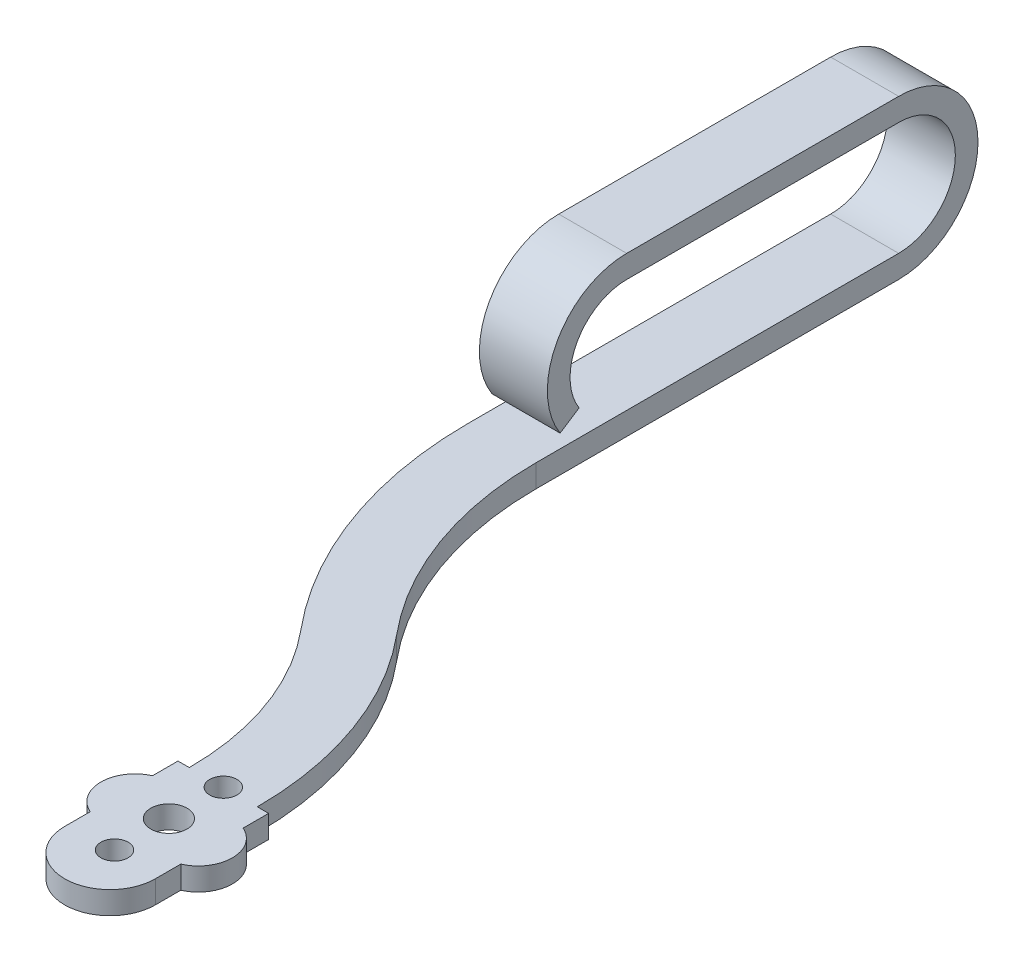
from build123d import *

# Parameters (mm, degrees)
SCHIZZO2_W                   = 15
SCHIZZO2_H                   = 5
SCHIZZO5_W                   = 15
SCHIZZO5_H                   = 5
SCHIZZO9_R                   = 3
SCHIZZO9_R_2                 = 4
ESTRUSIONE_ESTRUSIONE1_DEPTH = 5
SCHIZZO10_R                  = 3
TAGLIO_ESTRUSIONE1_DEPTH     = 144.674980425


with BuildPart() as part:
    # Sweep1: sweep along a path in Schizzo1
    with BuildLine(Plane.ZY) as sweep1_path:
        Line((0, 0), (-80, 0))
        ThreePointArc((-80, 0), (-97.5, 17.5), (-80, 35))
        Line((-80, 35), (-20, 35))
        ThreePointArc((-20, 35), (-4.629573851, 25.866600265), (-5.303061543, 8))
    # Schizzo2 → Sweep1 (sweep)
    with BuildSketch(Plane(origin=(0, 0, 0), x_dir=(-1, 0, 0), z_dir=(0, 0, -1))):
        with Locations((0, 2.5)):
            Rectangle(SCHIZZO2_W, SCHIZZO2_H)
    sweep(path=sweep1_path.line)

    # Sweep2: sweep along a path in Schizzo3
    with BuildLine(Plane.XZ) as sweep2_path:
        ThreePointArc((42.5, 96.5), (37.98987096, 70.837222968), (25, 48.25))
        ThreePointArc((25, 48.25), (12.01012904, 25.662777032), (7.5, 0))
    # Schizzo5 → Sweep2 (sweep)
    with BuildSketch(Plane.XY):
        with Locations((0, 2.5)):
            Rectangle(SCHIZZO5_W, SCHIZZO5_H)
    sweep(path=sweep2_path.line)

    # Schizzo9 → Estrusione-Estrusione1 (add)
    with BuildSketch(Plane.XZ):
        with BuildLine():
            Line((25, 96.5), (45, 96.5))
            Line((45, 96.5), (45, 102.126136458))
            ThreePointArc((45, 102.126136458), (49.5, 109), (45, 115.873863542))
            Line((45, 115.873863542), (45, 121.5))
            ThreePointArc((45, 121.5), (35, 131.5), (25, 121.5))
            Line((25, 121.5), (25, 115.873863542))
            ThreePointArc((25, 115.873863542), (20.5, 109), (25, 102.126136458))
            Line((25, 102.126136458), (25, 96.5))
        make_face()
        with Locations(Location((35, 120.5, 0), (0, 0, 270))):
            Circle(SCHIZZO9_R, mode=Mode.SUBTRACT)
        with Locations(Location((35, 108.5, 0), (0, 0, 270))):
            Circle(SCHIZZO9_R_2, mode=Mode.SUBTRACT)
    extrude(amount=-ESTRUSIONE_ESTRUSIONE1_DEPTH)

    # Schizzo10 → Taglio-Estrusione1 (cut, through all)
    with BuildSketch(Plane(origin=(0, 5, 0), x_dir=(1, 0, 0), z_dir=(0, 1, 0))):
        with Locations(Location((35, -96.5, 0), (0, 0, 270))):
            Circle(SCHIZZO10_R)
    extrude(amount=-TAGLIO_ESTRUSIONE1_DEPTH, mode=Mode.SUBTRACT)


solid = part.part
